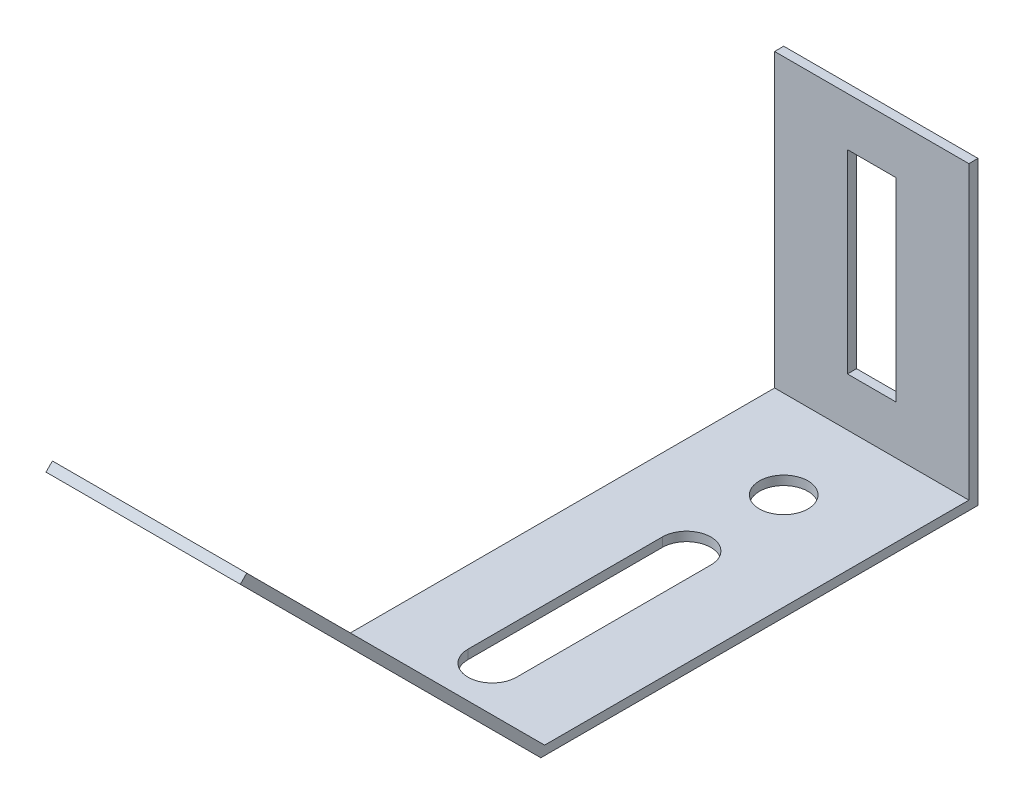
from build123d import *

# Parameters (mm, degrees)
SKETCH1_W           = 12.7
SKETCH1_H           = 28.575
SKETCH1_R           = 1.5875
BOSS_EXTRUDE1_DEPTH = 0.5953125
SKETCH3_W           = 12.7
SKETCH3_H           = 19.05
SKETCH3_W_2         = 3.175
SKETCH3_H_2         = 12.7
BOSS_EXTRUDE2_DEPTH = 0.5953125
BOSS_EXTRUDE3_DEPTH = 12.7


with BuildPart() as part:
    # Sketch1 → Boss-Extrude1 (new body)
    with BuildSketch(Plane(origin=(0, 0, 0), x_dir=(1, 0, 0), z_dir=(0, 1, 0))):
        Rectangle(SKETCH1_W, SKETCH1_H)
        with Locations(Location((0, 7.9375, 0), (0, 0, 90))):
            Circle(SKETCH1_R, mode=Mode.SUBTRACT)
        with BuildLine():
            Line((1.5875, 1.5875), (1.5875, -11.1125))
            ThreePointArc((1.5875, -11.1125), (0, -12.7), (-1.5875, -11.1125))
            Line((-1.5875, -11.1125), (-1.5875, 1.5875))
            ThreePointArc((-1.5875, 1.5875), (0, 3.175), (1.5875, 1.5875))
        make_face(mode=Mode.SUBTRACT)
    extrude(amount=BOSS_EXTRUDE1_DEPTH)

    # Sketch3 → Boss-Extrude2 (add)
    with BuildSketch(Plane(origin=(0, 0, -14.2875), x_dir=(-1, 0, 0), z_dir=(0, 0, -1))):
        with Locations((0, 10.1203125)):
            Rectangle(SKETCH3_W, SKETCH3_H)
        with Locations((0, 10.1203125)):
            Rectangle(SKETCH3_W_2, SKETCH3_H_2, mode=Mode.SUBTRACT)
    extrude(amount=-BOSS_EXTRUDE2_DEPTH)

    # Sketch4 → Boss-Extrude3 (add)
    with BuildSketch(Plane(origin=(6.35, 0, 0), x_dir=(0, 0, -1), z_dir=(1, 0, 0))):
        Polygon((-14.2875, 0), (-33.9328125, 19.6453125), (-33.511862994, 20.066262006), (-14.040913489, 0.5953125), (-14.2875, 0.5953125), align=None)
    extrude(amount=-BOSS_EXTRUDE3_DEPTH)


solid = part.part
